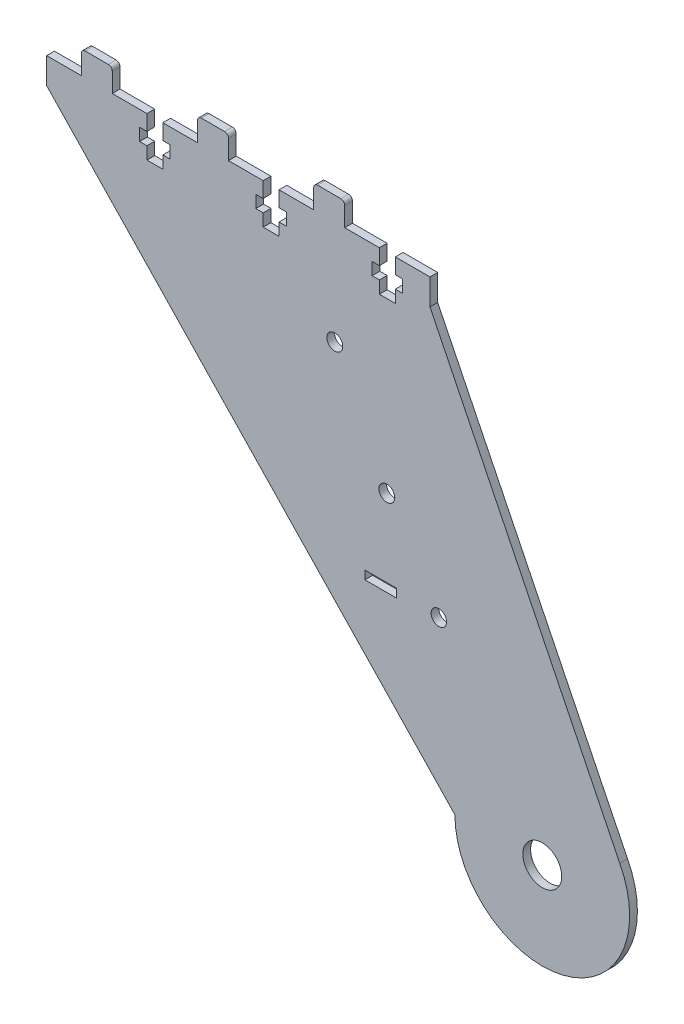
from build123d import *

# Parameters (mm, degrees)
SKETCH_1_R      = 2
SKETCH_1_R_2    = 5.02
SKETCH_1_R_3    = 2.05
SKETCH_1_W      = 8.2
SKETCH_1_H      = 2.2
EXTRUDE_1_DEPTH = 2
FILLET_1_R      = 1


with BuildPart() as part:
    # 草图1 → 凸台-拉伸1 (new body)
    with BuildSketch(Plane.XY):
        with BuildLine():
            Line((-38.25, 64.25), (-38.25, 60.25))
            Line((-38.25, 60.25), (-40.15, 60.25))
            Line((-40.15, 60.25), (-40.15, 57.05))
            Line((-40.15, 57.05), (-38.25, 57.05))
            Line((-38.25, 57.05), (-38.25, 53.85))
            Line((-38.25, 53.85), (-34.15, 53.85))
            Line((-34.15, 53.85), (-34.15, 57.05))
            Line((-34.15, 57.05), (-32.25, 57.05))
            Line((-32.25, 57.05), (-32.25, 60.25))
            Line((-32.25, 60.25), (-34.15, 60.25))
            Line((-34.15, 60.25), (-34.15, 64.25))
            Line((-34.15, 64.25), (-25.2, 64.25))
            Line((-25.2, 64.25), (-25.2, 70.25))
            Line((-25.2, 70.25), (-17.2, 70.25))
            Line((-17.2, 70.25), (-17.2, 64.25))
            Line((-17.2, 64.25), (-8.25, 64.25))
            Line((-8.25, 64.25), (-8.25, 60.25))
            Line((-8.25, 60.25), (-10.15, 60.25))
            Line((-10.15, 60.25), (-10.15, 57.05))
            Line((-10.15, 57.05), (-8.25, 57.05))
            Line((-8.25, 57.05), (-8.25, 53.85))
            Line((-8.25, 53.85), (-4.15, 53.85))
            Line((-4.15, 53.85), (-4.15, 57.05))
            Line((-4.15, 57.05), (-2.25, 57.05))
            Line((-2.25, 57.05), (-2.25, 60.25))
            Line((-2.25, 60.25), (-4.15, 60.25))
            Line((-4.15, 60.25), (-4.15, 64.25))
            Line((-4.15, 64.25), (4.8, 64.25))
            Line((4.8, 64.25), (4.8, 57.55))
            Line((4.8, 57.55), (53.793343317, -42.319549886))
            ThreePointArc((53.793343317, -42.319549886), (39.164608528, -74.656513398), (11.24, -52.75))
            Line((11.24, -52.75), (-94.15, 57.55))
            Line((-94.15, 57.55), (-94.15, 64.25))
            Line((-94.15, 64.25), (-85.2, 64.25))
            Line((-85.2, 64.25), (-85.2, 70.25))
            Line((-85.2, 70.25), (-77.2, 70.25))
            Line((-77.2, 70.25), (-77.2, 64.25))
            Line((-77.2, 64.25), (-68.25, 64.25))
            Line((-68.25, 64.25), (-68.25, 60.25))
            Line((-68.25, 60.25), (-70.15, 60.25))
            Line((-70.15, 60.25), (-70.15, 57.05))
            Line((-70.15, 57.05), (-68.25, 57.05))
            Line((-68.25, 57.05), (-68.25, 53.85))
            Line((-68.25, 53.85), (-64.15, 53.85))
            Line((-64.15, 53.85), (-64.15, 57.05))
            Line((-64.15, 57.05), (-62.25, 57.05))
            Line((-62.25, 57.05), (-62.25, 60.25))
            Line((-62.25, 60.25), (-64.15, 60.25))
            Line((-64.15, 60.25), (-64.15, 64.25))
            Line((-64.15, 64.25), (-55.2, 64.25))
            Line((-55.2, 64.25), (-55.2, 70.25))
            Line((-55.2, 70.25), (-47.2, 70.25))
            Line((-47.2, 70.25), (-47.2, 64.25))
            Line((-47.2, 64.25), (-38.25, 64.25))
        make_face()
        with Locations((7.098407643, -10.75)):
            Circle(SKETCH_1_R, mode=Mode.SUBTRACT)
        with Locations((33.795, -52.75)):
            Circle(SKETCH_1_R_2, mode=Mode.SUBTRACT)
        with Locations((-6.332168895, 10.336005166)):
            Circle(SKETCH_1_R_3, mode=Mode.SUBTRACT)
        with Locations((-19.762745434, 37.422010331)):
            Circle(SKETCH_1_R_3, mode=Mode.SUBTRACT)
        with Locations((-7.901592357, -10.75)):
            Rectangle(SKETCH_1_W, SKETCH_1_H, mode=Mode.SUBTRACT)
    extrude(amount=EXTRUDE_1_DEPTH)

    # 圆角1
    fillet_1_edges = [part.edges().sort_by_distance(p)[0] for p in [
        (-25.2, 70.25, 1),
        (-17.2, 70.25, 1),
        (-85.2, 70.25, 1),
        (-77.2, 70.25, 1),
        (-55.2, 70.25, 1),
        (-47.2, 70.25, 1),
    ]]
    fillet(fillet_1_edges, radius=FILLET_1_R)


solid = part.part
